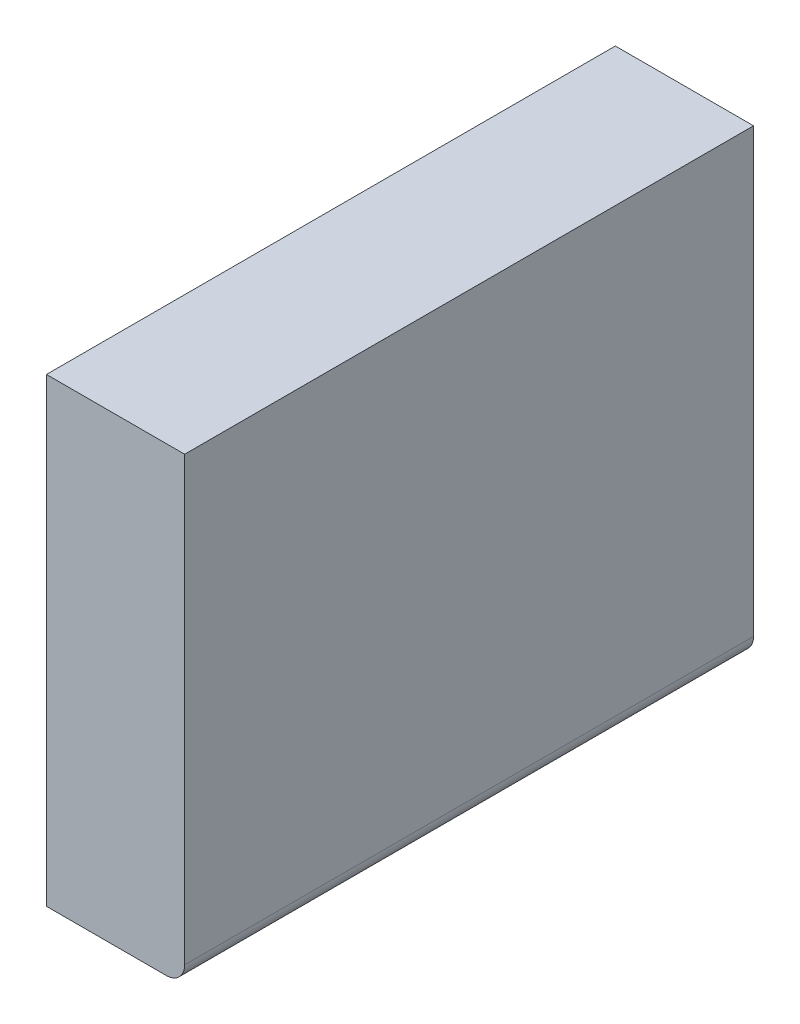
from build123d import *

# Parameters (mm, degrees)
SKETCH1_W           = 15
SKETCH1_H           = 50
BOSS_EXTRUDE1_DEPTH = 30.875
FILLET1_R           = 2


with BuildPart() as part:
    # Sketch1 → Boss-Extrude1 (new, symmetric)
    with BuildSketch(Plane.XY):
        with Locations((0, -25)):
            Rectangle(SKETCH1_W, SKETCH1_H)
    extrude(amount=BOSS_EXTRUDE1_DEPTH, both=True)

    # Fillet1
    fillet1_edges = [part.edges().sort_by_distance(p)[0] for p in [
        (7.5, -50, 0),
    ]]
    fillet(fillet1_edges, radius=FILLET1_R)


solid = part.part
